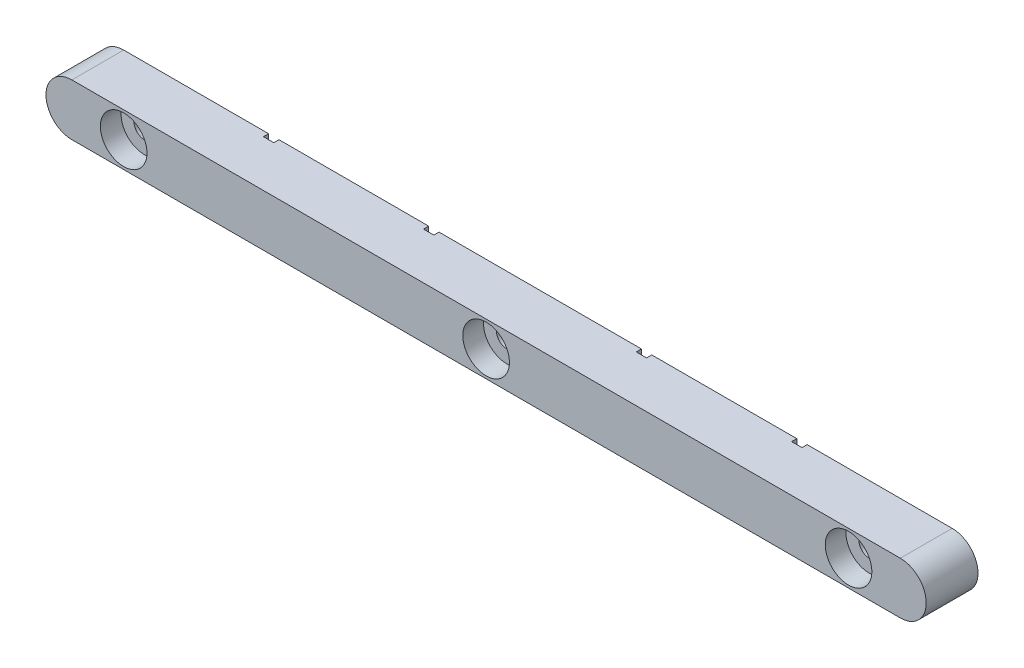
from build123d import *

# Parameters (mm, degrees)
SKETCH_1_R          = 1
EXTRUDE_1_DEPTH     = 5
SKETCH_2_W          = 1
SKETCH_2_H          = 5
CUT_EXTRUDE_1_DEPTH = 0.5
SKETCH_3_R          = 2.25
CUT_EXTRUDE_3_DEPTH = 2


with BuildPart() as part:
    # 草图1 → 凸台-拉伸1 (new body)
    with BuildSketch(Plane.XY):
        with BuildLine():
            Line((-40, 2.5), (40, 2.5))
            ThreePointArc((40, 2.5), (42.500000092, 0), (40, -2.5))
            Line((40, -2.5), (-40, -2.5))
            ThreePointArc((-40, -2.5), (-42.5, 0), (-40, 2.5))
        make_face()
        with Locations((-35, 0)):
            Circle(SKETCH_1_R, mode=Mode.SUBTRACT)
        Circle(SKETCH_1_R, mode=Mode.SUBTRACT)
        with Locations((35, 0)):
            Circle(SKETCH_1_R, mode=Mode.SUBTRACT)
    extrude(amount=EXTRUDE_1_DEPTH)

    # 草图2 → 切除-拉伸1 (cut)
    with BuildSketch(Plane(origin=(0, 0, 0), x_dir=(-1, 0, 0), z_dir=(0, 0, -1))):
        with Locations((-25.5, 0)):
            Rectangle(SKETCH_2_W, SKETCH_2_H)
        with Locations((-10.5, 0)):
            Rectangle(SKETCH_2_W, SKETCH_2_H)
        with Locations((10.044565055, 0)):
            Rectangle(SKETCH_2_W, SKETCH_2_H)
        with Locations((25.5, 0)):
            Rectangle(SKETCH_2_W, SKETCH_2_H)
    extrude(amount=-CUT_EXTRUDE_1_DEPTH, mode=Mode.SUBTRACT)

    # 草图3 → 切除-拉伸3 (cut)
    with BuildSketch(Plane.XY.offset(5)):
        with Locations((-35, 0)):
            Circle(SKETCH_3_R)
        Circle(SKETCH_3_R)
        with Locations((35, 0)):
            Circle(SKETCH_3_R)
    extrude(amount=-CUT_EXTRUDE_3_DEPTH, mode=Mode.SUBTRACT)


solid = part.part
